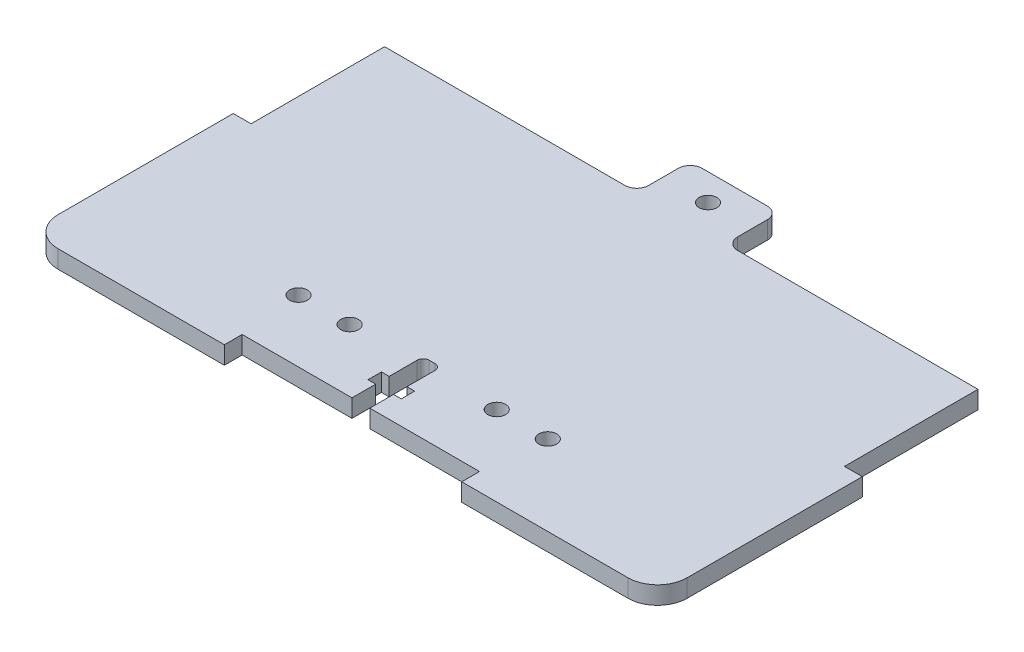
from build123d import *

# Parameters (mm, degrees)
SKETCH1_W               = 106
SKETCH1_H               = 57
BOSS_EXTRUDE1_DEPTH     = 1.5
CUT_EXTRUDE1_DEPTH      = 61.195514783
CUT_EXTRUDE1_DEPTH_BACK = 61.195514783
SKETCH2_W               = 3
SKETCH2_H               = 22.5
SKETCH2_W_2             = 40
SKETCH2_H_2             = 3
SKETCH4_W               = 15
SKETCH4_H               = 9
BOSS_EXTRUDE2_DEPTH     = 1.5
FILLET1_R               = 2
CUT_EXTRUDE2_DEPTH      = 65.942282066
CUT_EXTRUDE2_DEPTH_BACK = 65.942282066
CUT_EXTRUDE3_DEPTH      = 65.942282066
CUT_EXTRUDE3_DEPTH_BACK = 65.942282066
SKETCH5_R               = 1.5
FILLET2_R               = 5
CUT_EXTRUDE4_DEPTH      = 65.942282066
CUT_EXTRUDE4_DEPTH_BACK = 65.942282066
SKETCH6_R               = 1.5


with BuildPart() as part:
    # Sketch1 → Boss-Extrude1 (new, symmetric)
    with BuildSketch(Plane(origin=(0, 0, 0), x_dir=(1, 0, 0), z_dir=(0, 1, 0))):
        Rectangle(SKETCH1_W, SKETCH1_H)
    extrude(amount=BOSS_EXTRUDE1_DEPTH, both=True)

    # Sketch2 → Cut-Extrude1 (cut, two sides: drawn at the far end of the back side and taken through both)
    with BuildSketch(Plane(origin=(0, 0, 0), x_dir=(1, 0, 0), z_dir=(0, 1, 0)).offset(-CUT_EXTRUDE1_DEPTH_BACK)):
        with Locations((-51.5, 17.25)):
            Rectangle(SKETCH2_W, SKETCH2_H)
        with Locations((51.5, 17.25)):
            Rectangle(SKETCH2_W, SKETCH2_H)
        with Locations((0, -27)):
            Rectangle(SKETCH2_W_2, SKETCH2_H_2)
    extrude(amount=CUT_EXTRUDE1_DEPTH + CUT_EXTRUDE1_DEPTH_BACK, mode=Mode.SUBTRACT)

    # Sketch4 → Boss-Extrude2 (add, symmetric)
    with BuildSketch(Plane(origin=(0, 0, 0), x_dir=(1, 0, 0), z_dir=(0, 1, 0))):
        with Locations((0, 33)):
            Rectangle(SKETCH4_W, SKETCH4_H)
    extrude(amount=BOSS_EXTRUDE2_DEPTH, both=True)

    # Fillet1
    fillet1_edges = [part.edges().sort_by_distance(p)[0] for p in [
        (-7.5, 0, -37.5),
        (-7.5, 0, -28.5),
        (7.5, 0, -28.5),
        (7.5, 0, -37.5),
    ]]
    fillet(fillet1_edges, radius=FILLET1_R)

    # Sketch3 → Cut-Extrude2 (cut, two sides: drawn at the far end of the back side and taken through both)
    with BuildSketch(Plane(origin=(0, 0, 0), x_dir=(1, 0, 0), z_dir=(0, 1, 0)).offset(-CUT_EXTRUDE2_DEPTH_BACK)):
        with BuildLine():
            Line((-1.5, -25.5), (1.5, -25.5))
            Line((1.5, -25.5), (1.5, -21.5))
            Line((1.5, -21.5), (2.8, -21.5))
            Line((2.8, -21.5), (2.8, -19.23))
            Line((2.8, -19.23), (1.5, -19.23))
            Line((1.5, -19.23), (1.5, -14.5))
            ThreePointArc((1.5, -14.5), (1.207106781, -13.792893219), (0.5, -13.5))
            Line((0.5, -13.5), (-0.5, -13.5))
            ThreePointArc((-0.5, -13.5), (-1.207106781, -13.792893219), (-1.5, -14.5))
            Line((-1.5, -14.5), (-1.5, -19.23))
            Line((-1.5, -19.23), (-2.8, -19.23))
            Line((-2.8, -19.23), (-2.8, -21.5))
            Line((-2.8, -21.5), (-1.5, -21.5))
            Line((-1.5, -21.5), (-1.5, -25.5))
        make_face()
    extrude(amount=CUT_EXTRUDE2_DEPTH + CUT_EXTRUDE2_DEPTH_BACK, mode=Mode.SUBTRACT)

    # Sketch5 → Cut-Extrude3 (cut, two sides: drawn at the far end of the back side and taken through both)
    with BuildSketch(Plane(origin=(0, 0, 0), x_dir=(1, 0, 0), z_dir=(0, 1, 0)).offset(-CUT_EXTRUDE3_DEPTH_BACK)):
        with Locations(Location((0, 33, 0), (0, 0, 270))):
            Circle(SKETCH5_R)
    extrude(amount=CUT_EXTRUDE3_DEPTH + CUT_EXTRUDE3_DEPTH_BACK, mode=Mode.SUBTRACT)

    # Fillet2
    fillet2_edges = [part.edges().sort_by_distance(p)[0] for p in [
        (53, 0, 28.5),
        (-53, 0, 28.5),
    ]]
    fillet(fillet2_edges, radius=FILLET2_R)

    # Sketch6 → Cut-Extrude4 (cut, two sides: drawn at the far end of the back side and taken through both)
    with BuildSketch(Plane(origin=(0, 0, 0), x_dir=(1, 0, 0), z_dir=(0, 1, 0)).offset(-CUT_EXTRUDE4_DEPTH_BACK)):
        with Locations(Location((-21, -15, 0), (0, 0, 270))):
            Circle(SKETCH6_R)
        with Locations(Location((-12.4, -15, 0), (0, 0, 270))):
            Circle(SKETCH6_R)
        with Locations(Location((12.4, -15, 0), (0, 0, 90))):
            Circle(SKETCH6_R)
        with Locations(Location((21, -15, 0), (0, 0, 90))):
            Circle(SKETCH6_R)
    extrude(amount=CUT_EXTRUDE4_DEPTH + CUT_EXTRUDE4_DEPTH_BACK, mode=Mode.SUBTRACT)


solid = part.part
